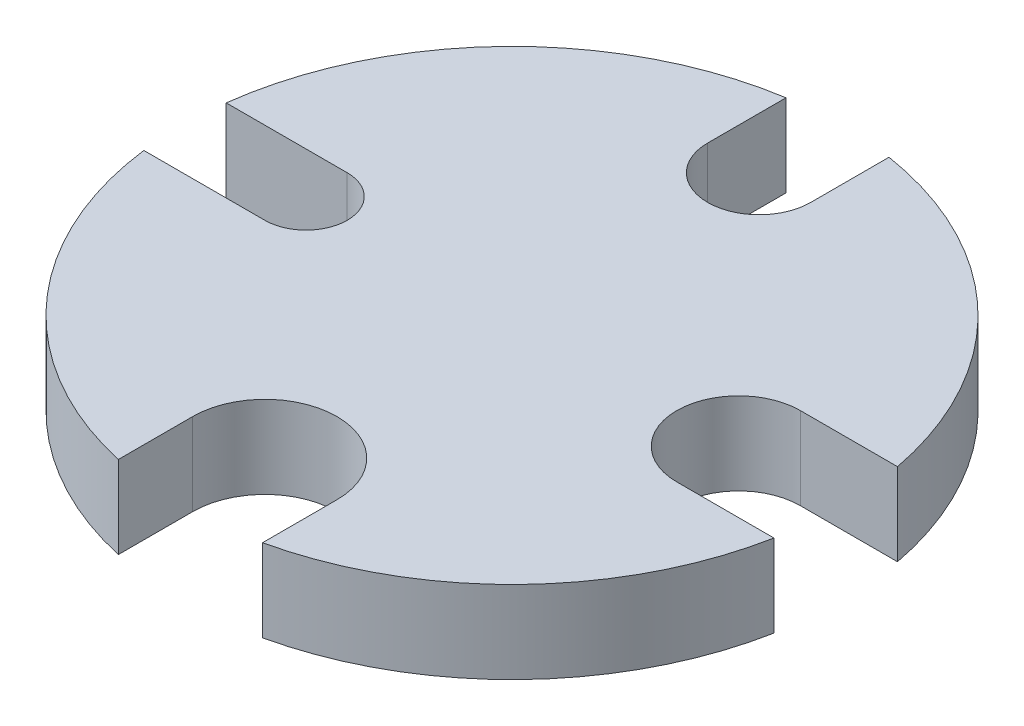
from build123d import *

# Parameters (mm, degrees)
BOSS_EXTRUDE1_DEPTH = 25.4


with BuildPart() as part:
    # Sketch1 → Boss-Extrude1 (new body)
    with BuildSketch(Plane(origin=(0, 0, 0), x_dir=(1, 0, 0), z_dir=(0, 1, 0))):
        with BuildLine():
            ThreePointArc((-100.803124952, -12.7), (-75.179251769, -68.342081498), (-22.225, -99.139343225))
            Line((-22.225, -99.139343225), (-22.225, -76.2))
            ThreePointArc((-22.225, -76.2), (0, -53.975), (22.225, -76.2))
            Line((22.225, -76.2), (22.225, -99.139343225))
            ThreePointArc((22.225, -99.139343225), (72.97933927, -70.686462917), (99.798083649, -19.05))
            Line((99.798083649, -19.05), (69.85, -19.05))
            ThreePointArc((69.85, -19.05), (50.8, 0), (69.85, 19.05))
            Line((69.85, 19.05), (99.798083649, 19.05))
            ThreePointArc((99.798083649, 19.05), (70.693518214, 72.972504977), (15.875, 100.352101996))
            Line((15.875, 100.352101996), (15.875, 76.2))
            ThreePointArc((15.875, 76.2), (0, 60.325), (-15.875, 76.2))
            Line((-15.875, 76.2), (-15.875, 100.352101996))
            ThreePointArc((-15.875, 100.352101996), (-72.966903159, 70.699300162), (-100.803124952, 12.7))
            Line((-100.803124952, 12.7), (-63.5, 12.7))
            ThreePointArc((-63.5, 12.7), (-50.8, 0), (-63.5, -12.7))
            Line((-63.5, -12.7), (-100.803124952, -12.7))
        make_face()
    extrude(amount=BOSS_EXTRUDE1_DEPTH)


solid = part.part
